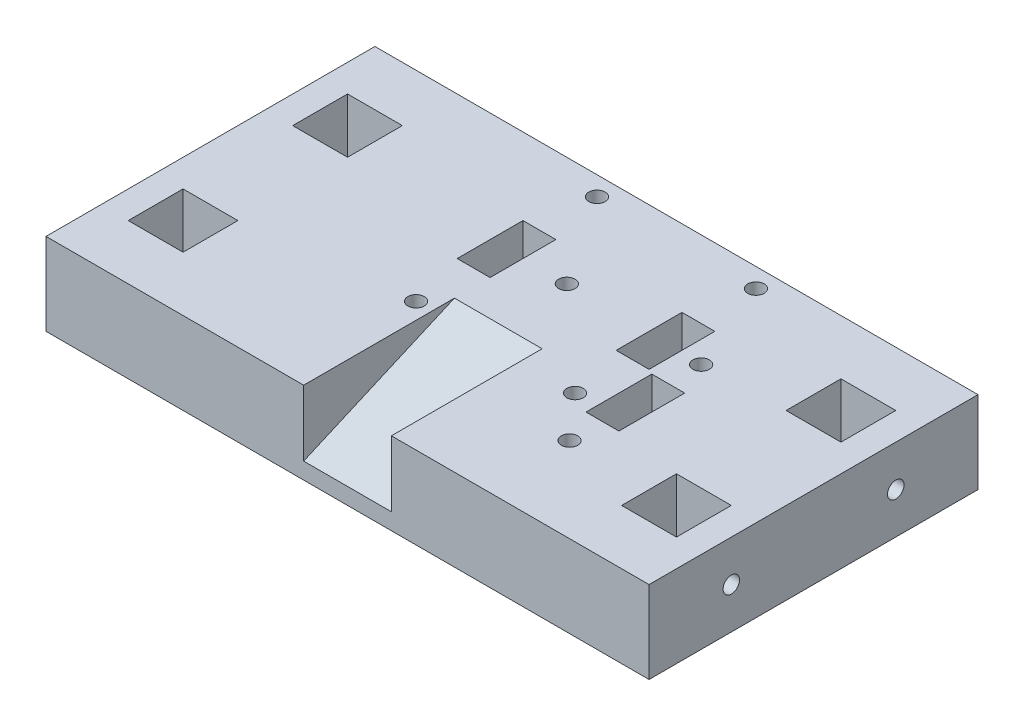
from build123d import *

# Parameters (mm, degrees)
CROQUIS1_W              = 80
CROQUIS1_H              = 60
CROQUIS1_R              = 1.5
CROQUIS1_W_2            = 6
CROQUIS1_H_2            = 25
CROQUIS1_W_3            = 10
CROQUIS1_H_3            = 20
CROQUIS1_H_4            = 10
CROQUIS1_W_4            = 5
CROQUIS1_H_5            = 6.5
SALIENTE_EXTRUIR1_DEPTH = 15
CORTAR_EXTRUIR1_DEPTH   = 10
CROQUIS3_R              = 1.5
CORTAR_EXTRUIR2_DEPTH   = 25
CORTAR_EXTRUIR3_START   = -25
CROQUIS6_R              = 1.5
CORTAR_EXTRUIR3_DEPTH   = 25
CROQUIS8_W              = 16
CROQUIS8_H              = 17.848141148
CROQUIS8_R              = 1.5
SALIENTE_EXTRUIR2_DEPTH = 5
CORTAR_EXTRUIR4_START   = -55
CORTAR_EXTRUIR4_DEPTH   = 8
CROQUIS10_R             = 1.5
CROQUIS10_W             = 6
CROQUIS10_H             = 12
CORTAR_EXTRUIR5_DEPTH   = 16
CORTAR_EXTRUIR6_DEPTH   = 10


with BuildPart() as part:
    # Croquis1 → Saliente-Extruir1 (new body)
    # profile 1 of 13: a face of its own
    with BuildSketch(Plane(origin=(0, 0, 0), x_dir=(1, 0, 0), z_dir=(0, 1, 0))):
        with Locations((0, -10)):
            Rectangle(CROQUIS1_W, CROQUIS1_H)
        with Locations(Location((18, -16.5, 0), (0, 0, 270))):
            Circle(CROQUIS1_R, mode=Mode.SUBTRACT)
        with Locations(Location((-11, -16.5, 0), (0, 0, 270))):
            Circle(CROQUIS1_R, mode=Mode.SUBTRACT)
        with Locations(Location((18, 16.5, 0), (0, 0, 270))):
            Circle(CROQUIS1_R, mode=Mode.SUBTRACT)
        with Locations(Location((-11, 16.5, 0), (0, 0, 270))):
            Circle(CROQUIS1_R, mode=Mode.SUBTRACT)
        with Locations((18, 0)):
            Rectangle(CROQUIS1_W_2, CROQUIS1_H_2, mode=Mode.SUBTRACT)
        Polygon((6.711696879, 3.875), (0, 7.75), (-6.711696879, 3.875), (-6.711696879, -3.875), (0, -7.75), (6.711696879, -3.875), align=None, mode=Mode.SUBTRACT)
        with Locations((-11, 0)):
            Rectangle(CROQUIS1_W_2, CROQUIS1_H_2, mode=Mode.SUBTRACT)
    # profile 2 of 13: a face of its own
    with BuildSketch(Plane(origin=(0, 0, 0), x_dir=(1, 0, 0), z_dir=(0, 1, 0))):
        with Locations((-45, -10)):
            Rectangle(CROQUIS1_W_3, CROQUIS1_H_3)
    # profile 3 of 13: a face of its own
    with BuildSketch(Plane(origin=(0, 0, 0), x_dir=(1, 0, 0), z_dir=(0, 1, 0))):
        with Locations((-45, -35)):
            Rectangle(CROQUIS1_W_3, CROQUIS1_H_4)
    # profile 4 of 13: a face of its own
    with BuildSketch(Plane(origin=(0, 0, 0), x_dir=(1, 0, 0), z_dir=(0, 1, 0))):
        with Locations((-52.5, -10)):
            Rectangle(CROQUIS1_W_4, CROQUIS1_H)
    # profile 5 of 13: a face of its own
    with BuildSketch(Plane(origin=(0, 0, 0), x_dir=(1, 0, 0), z_dir=(0, 1, 0))):
        with Locations((-45, 15)):
            Rectangle(CROQUIS1_W_3, CROQUIS1_H_4)
    # profile 6 of 13: a face of its own
    with BuildSketch(Plane(origin=(0, 0, 0), x_dir=(1, 0, 0), z_dir=(0, 1, 0))):
        with Locations((45, 15)):
            Rectangle(CROQUIS1_W_3, CROQUIS1_H_4)
    # profile 7 of 13: a face of its own
    with BuildSketch(Plane(origin=(0, 0, 0), x_dir=(1, 0, 0), z_dir=(0, 1, 0))):
        with Locations((52.5, -10)):
            Rectangle(CROQUIS1_W_4, CROQUIS1_H)
    # profile 8 of 13: a face of its own
    with BuildSketch(Plane(origin=(0, 0, 0), x_dir=(1, 0, 0), z_dir=(0, 1, 0))):
        with Locations((45, -10)):
            Rectangle(CROQUIS1_W_3, CROQUIS1_H_3)
    # profile 9 of 13: a face of its own
    with BuildSketch(Plane(origin=(0, 0, 0), x_dir=(1, 0, 0), z_dir=(0, 1, 0))):
        with Locations((45, -35)):
            Rectangle(CROQUIS1_W_3, CROQUIS1_H_4)
    # profile 10 of 13: a face of its own
    with BuildSketch(Plane(origin=(0, 0, 0), x_dir=(1, 0, 0), z_dir=(0, 1, 0))):
        with Locations((-11, 9.25)):
            Rectangle(CROQUIS1_W_2, CROQUIS1_H_5)
    # profile 11 of 13: a face of its own
    with BuildSketch(Plane(origin=(0, 0, 0), x_dir=(1, 0, 0), z_dir=(0, 1, 0))):
        with Locations((-11, -9.25)):
            Rectangle(CROQUIS1_W_2, CROQUIS1_H_5)
    # profile 12 of 13: a face of its own
    with BuildSketch(Plane(origin=(0, 0, 0), x_dir=(1, 0, 0), z_dir=(0, 1, 0))):
        with Locations((18, 9.25)):
            Rectangle(CROQUIS1_W_2, CROQUIS1_H_5)
    # profile 13 of 13: a face of its own
    with BuildSketch(Plane(origin=(0, 0, 0), x_dir=(1, 0, 0), z_dir=(0, 1, 0))):
        with Locations((18, -9.25)):
            Rectangle(CROQUIS1_W_2, CROQUIS1_H_5)
    extrude(amount=SALIENTE_EXTRUIR1_DEPTH)

    # Croquis2 → Cortar-Extruir1 (cut)
    with BuildSketch(Plane.XZ):
        Polygon((-7.391560818, 16.5), (-9.195780409, 19.625), (-12.804219591, 19.625), (-14.608439182, 16.5), (-12.804219591, 13.375), (-9.195780409, 13.375), align=None)
        Polygon((21.608439182, 16.5), (19.804219591, 19.625), (16.195780409, 19.625), (14.391560818, 16.5), (16.195780409, 13.375), (19.804219591, 13.375), align=None)
        Polygon((-7.391560818, -16.5), (-9.195780409, -13.375), (-12.804219591, -13.375), (-14.608439182, -16.5), (-12.804219591, -19.625), (-9.195780409, -19.625), align=None)
        Polygon((21.608439182, -16.5), (19.804219591, -13.375), (16.195780409, -13.375), (14.391560818, -16.5), (16.195780409, -19.625), (19.804219591, -19.625), align=None)
    extrude(amount=-CORTAR_EXTRUIR1_DEPTH, mode=Mode.SUBTRACT)

    # Croquis3 → Cortar-Extruir2 (cut)
    with BuildSketch(Plane(origin=(55, 0, 0), x_dir=(0, 0, -1), z_dir=(1, 0, 0))):
        with Locations((-25, 7.5)):
            Circle(CROQUIS3_R)
        with Locations((5, 7.5)):
            Circle(CROQUIS3_R)
    extrude(amount=-CORTAR_EXTRUIR2_DEPTH, mode=Mode.SUBTRACT)

    # Croquis6 → Cortar-Extruir3 (cut)
    with BuildSketch(Plane.ZY.offset(55).offset(CORTAR_EXTRUIR3_START)):
        with Locations(Location((-5, 7.5, 0), (0, 0, 180))):
            Circle(CROQUIS6_R)
        with Locations(Location((25, 7.5, 0), (0, 0, 180))):
            Circle(CROQUIS6_R)
    extrude(amount=CORTAR_EXTRUIR3_DEPTH, mode=Mode.SUBTRACT)

    # Croquis8 → Saliente-Extruir2 (add)
    with BuildSketch(Plane(origin=(0, 15, 0), x_dir=(1, 0, 0), z_dir=(0, 1, 0))):
        Rectangle(CROQUIS8_W, CROQUIS8_H)
        with Locations(Location((0, 0, 0), (0, 0, 270))):
            Circle(CROQUIS8_R, mode=Mode.SUBTRACT)
    extrude(amount=-SALIENTE_EXTRUIR2_DEPTH)

    # Croquis9 → Cortar-Extruir4 (cut, symmetric)
    with BuildSketch(Plane(origin=(55, 0, 0), x_dir=(0, 0, -1), z_dir=(1, 0, 0)).offset(CORTAR_EXTRUIR4_START)):
        Polygon((-40, 3), (-12.5, 15), (-40, 15), align=None)
    extrude(amount=CORTAR_EXTRUIR4_DEPTH, both=True, mode=Mode.SUBTRACT)

    # Croquis10 → Cortar-Extruir5 (cut)
    with BuildSketch(Plane(origin=(0, 15, 0), x_dir=(1, 0, 0), z_dir=(0, 1, 0))):
        with Locations(Location((25, -0.5, 0), (0, 0, 270))):
            Circle(CROQUIS10_R)
        with Locations(Location((25, -24.5, 0), (0, 0, 270))):
            Circle(CROQUIS10_R)
        with Locations((25, -12.5)):
            Rectangle(CROQUIS10_W, CROQUIS10_H)
    extrude(amount=-CORTAR_EXTRUIR5_DEPTH, mode=Mode.SUBTRACT)

    # Croquis11 → Cortar-Extruir6 (cut)
    with BuildSketch(Plane.XZ):
        Polygon((28.608439182, 24.5), (26.804219591, 27.625), (23.195780409, 27.625), (21.391560818, 24.5), (23.195780409, 21.375), (26.804219591, 21.375), align=None)
        Polygon((28.608439182, 0.5), (26.804219591, 3.625), (23.195780409, 3.625), (21.391560818, 0.5), (23.195780409, -2.625), (26.804219591, -2.625), align=None)
    extrude(amount=-CORTAR_EXTRUIR6_DEPTH, mode=Mode.SUBTRACT)


solid = part.part
